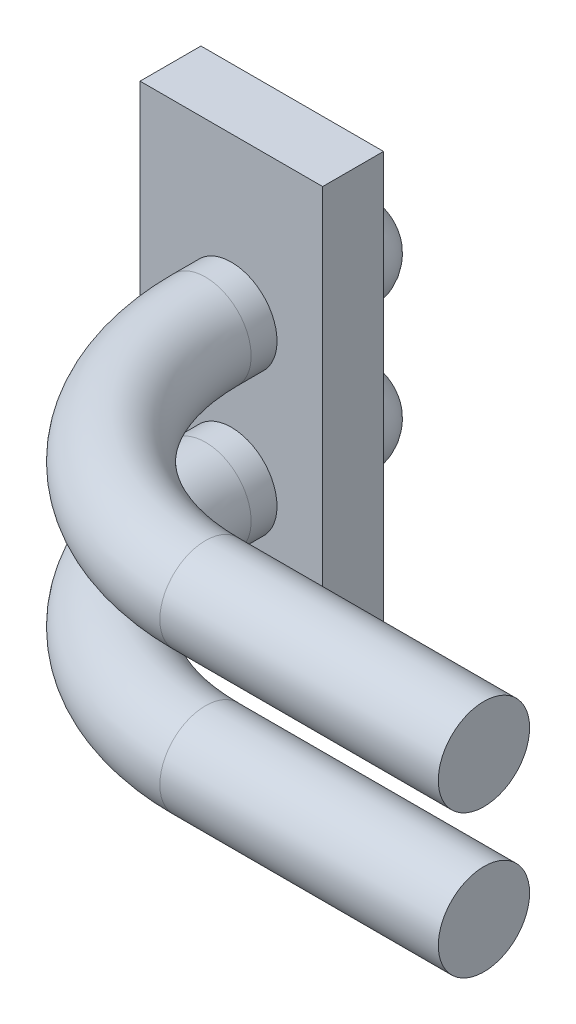
from build123d import *

# Parameters (mm, degrees)
SKETCH1_W           = 6
SKETCH1_H           = 15
BOSS_EXTRUDE1_DEPTH = 2
SKETCH2_R           = 1.5
BOSS_EXTRUDE2_DEPTH = 3
FILLET1_R           = 1.5
SKETCH3_R           = 1.5


with BuildPart() as part:
    # Sketch1 → Boss-Extrude1 (new body)
    with BuildSketch(Plane.XY):
        Rectangle(SKETCH1_W, SKETCH1_H)
    extrude(amount=BOSS_EXTRUDE1_DEPTH)

    # Sketch2 → Boss-Extrude2 (add)
    with BuildSketch(Plane(origin=(0, 0, 0), x_dir=(-1, 0, 0), z_dir=(0, 0, -1))):
        with Locations((0, 2.35)):
            Circle(SKETCH2_R)
        with Locations((0, -2.35)):
            Circle(SKETCH2_R)
    extrude(amount=BOSS_EXTRUDE2_DEPTH)

    # Fillet1
    fillet1_edges = [part.edges().sort_by_distance(p)[0] for p in [
        (1.5, 2.35, -3),
        (1.5, -2.35, -3),
    ]]
    fillet(fillet1_edges, radius=FILLET1_R)

    # Sweep1: sweep along a path in Sketch4
    with BuildLine(Plane(origin=(0, 2.35, 0), x_dir=(-1, 0, 0), z_dir=(0, 1, 0))) as sweep1_path:
        Line((0, 2), (0, 2.85))
        ThreePointArc((0, 2.85), (-2.196699141, 8.153300859), (-7.5, 10.35))
        Line((-7.5, 10.35), (-16.65, 10.35))
    # Sketch3 → Sweep1 (sweep)
    with BuildSketch(Plane.XY.offset(2)):
        with Locations((0, -2.35)):
            Circle(SKETCH3_R)
        with Locations((0, 2.35)):
            Circle(SKETCH3_R)
    sweep(path=sweep1_path.line)


solid = part.part
